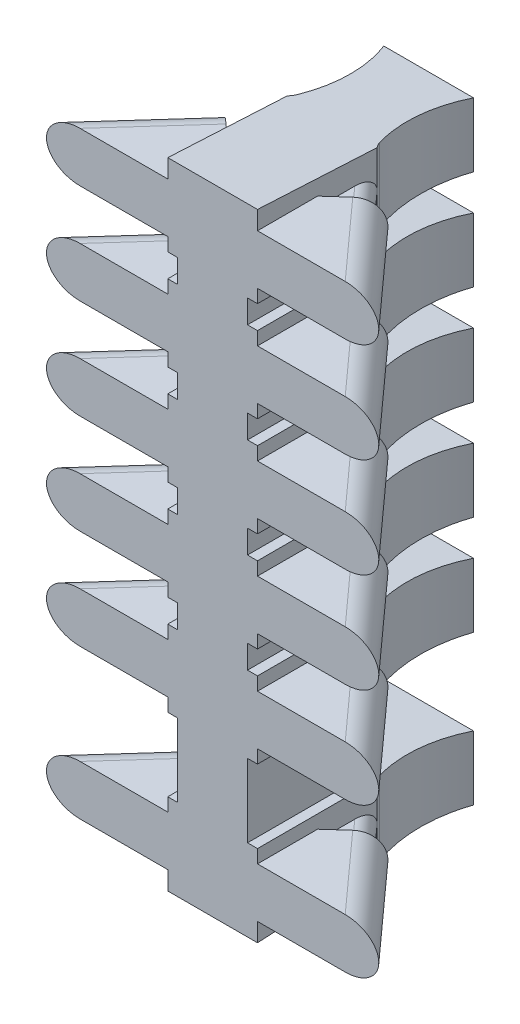
from build123d import *

# Parameters (mm, degrees)
SKETCH1_W           = 15
SKETCH1_H           = 30
BOSS_EXTRUDE1_DEPTH = 7
CUT_EXTRUDE1_START  = -0.3
CUT_EXTRUDE1_DEPTH  = 2.1
CUT_EXTRUDE4_DEPTH  = 2.7
BOSS_EXTRUDE2_DEPTH = 24.556743
CUT_EXTRUDE2_DEPTH  = 27.627139608
CUT_EXTRUDE3_DEPTH  = 27.401285317
SKETCH13_W          = 10
SKETCH13_H          = 20
BOSS_EXTRUDE3_DEPTH = 7


with BuildPart() as part:
    # Sketch1 → Boss-Extrude1 (new body)
    with BuildSketch(Plane.XY):
        Rectangle(SKETCH1_W, SKETCH1_H)
    extrude(amount=-BOSS_EXTRUDE1_DEPTH)

    # Sketch8 → Cut-Extrude1 (cut)
    with BuildSketch(Plane(origin=(1.35, 0, 0), x_dir=(0, 0, -1), z_dir=(1, 0, 0)).offset(CUT_EXTRUDE1_START)):
        Polygon((6.5, -4.716092451), (6.5, -2.783907549), (3, -2.600480321), (3, -1.899519679), (6.5, -1.716092451), (6.5, 0.216092451), (3, 0.399519679), (3, 1.100480321), (6.5, 1.283907549), (6.5, 3.216092451), (3, 3.399519679), (3, 4.100480321), (6.5, 4.283907549), (6.5, 6.216092451), (3, 6.399519679), (3, 7.100480321), (6.5, 7.283907549), (6.5, 9.216092451), (0, 9.556743017), (0, -9.556743017), (6.5, -9.216092451), (6.5, -7.283907549), (3, -7.100480321), (3, -4.899519679), align=None)
    extrude(amount=-CUT_EXTRUDE1_DEPTH, mode=Mode.SUBTRACT)

    # Sketch7 → Cut-Extrude4 (cut)
    with BuildSketch(Plane(origin=(1.35, 0, 0), x_dir=(0, 0, -1), z_dir=(1, 0, 0))):
        Polygon((3, 4.100480321), (0, 4.100480321), (0, 6.399519679), (3, 6.399519679), (6.5, 6.216092451), (6.5, 4.283907549), align=None)
        Polygon((3, 1.100480321), (0, 1.100480321), (0, 3.399519679), (3, 3.399519679), (6.5, 3.216092451), (6.5, 1.283907549), align=None)
        Polygon((3, -1.899519679), (0, -1.899519679), (0, 0.399519679), (3, 0.399519679), (6.5, 0.216092451), (6.5, -1.716092451), align=None)
        Polygon((3, -4.899519679), (0, -4.899519679), (0, -2.600480321), (3, -2.600480321), (6.5, -2.783907549), (6.5, -4.716092451), align=None)
        Polygon((3, -7.100480321), (0, -7.100480321), (0, -9.556743017), (6.5, -9.216092451), (6.5, -7.283907549), align=None)
        Polygon((3, 7.100480321), (0, 7.100480321), (0, 9.556743017), (6.5, 9.216092451), (6.5, 7.283907549), align=None)
    extrude(amount=-CUT_EXTRUDE4_DEPTH, mode=Mode.SUBTRACT)

    # Sketch10 → Boss-Extrude2 (add)
    with BuildSketch(Plane(origin=(0, -9.556743017, 0), x_dir=(1, 0, 0), z_dir=(0, 1, 0))):
        with BuildLine():
            Line((1.35, 3.599507213), (1.35, 6.5))
            ThreePointArc((1.35, 6.5), (1.052815056, 5.148153684), (1.246508191, 3.777646361))
            ThreePointArc((1.246508191, 3.777646361), (1.288979573, 3.683188656), (1.35, 3.599507213))
        make_face()
        with BuildLine():
            Line((-1.35, 3.599507213), (-1.35, 6.5))
            ThreePointArc((-1.35, 6.5), (-1.052815056, 5.148153684), (-1.246508191, 3.777646361))
            ThreePointArc((-1.246508191, 3.777646361), (-1.288979573, 3.683188656), (-1.35, 3.599507213))
        make_face()
    extrude(amount=BOSS_EXTRUDE2_DEPTH)

    # Sketch12 → Cut-Extrude2 (cut, through all)
    with BuildSketch(Plane(origin=(3.10411931, 9.156194078, -3.38952842), x_dir=(0, -1, 0), z_dir=(0.669702306213578, 0, 0.7426296661541438))):
        with BuildLine():
            Line((0.156194078, -1.612037756), (0.156194078, -5.06124645))
            Line((0.156194078, -5.06124645), (1.656194078, -5.06124645))
            Line((1.656194078, -5.06124645), (1.656194078, -1.612037756))
            ThreePointArc((1.656194078, -1.612037756), (0.906194078, -0.862037756), (0.156194078, -1.612037756))
        make_face()
        with BuildLine():
            Line((3.156194078, -1.612037756), (3.156194078, -5.06124645))
            Line((3.156194078, -5.06124645), (4.656194078, -5.06124645))
            Line((4.656194078, -5.06124645), (4.656194078, -1.612037756))
            ThreePointArc((4.656194078, -1.612037756), (3.906194078, -0.862037756), (3.156194078, -1.612037756))
        make_face()
        with BuildLine():
            Line((6.156194078, -1.612037756), (6.156194078, -5.06124645))
            Line((6.156194078, -5.06124645), (7.656194078, -5.06124645))
            Line((7.656194078, -5.06124645), (7.656194078, -1.612037756))
            ThreePointArc((7.656194078, -1.612037756), (6.906194078, -0.862037756), (6.156194078, -1.612037756))
        make_face()
        with BuildLine():
            Line((9.156194078, -1.612037756), (9.156194078, -5.06124645))
            Line((9.156194078, -5.06124645), (10.656194078, -5.06124645))
            Line((10.656194078, -5.06124645), (10.656194078, -1.612037756))
            ThreePointArc((10.656194078, -1.612037756), (9.906194078, -0.862037756), (9.156194078, -1.612037756))
        make_face()
        with BuildLine():
            Line((12.156194078, -1.612037756), (12.156194078, -5.06124645))
            Line((12.156194078, -5.06124645), (13.656194078, -5.06124645))
            Line((13.656194078, -5.06124645), (13.656194078, -1.612037756))
            ThreePointArc((13.656194078, -1.612037756), (12.906194078, -0.862037756), (12.156194078, -1.612037756))
        make_face()
        with BuildLine():
            Line((16.656194078, -1.612037756), (16.656194078, -5.06124645))
            Line((16.656194078, -5.06124645), (18.156194078, -5.06124645))
            Line((18.156194078, -5.06124645), (18.156194078, -1.612037756))
            ThreePointArc((18.156194078, -1.612037756), (17.406194078, -0.862037756), (16.656194078, -1.612037756))
        make_face()
    cut_extrude2 = extrude(amount=CUT_EXTRUDE2_DEPTH, mode=Mode.SUBTRACT)

    # Sketch11 → Cut-Extrude3 (cut, through all)
    with BuildSketch(Plane(origin=(2.212963711, 9.156194078, -4.377726578), x_dir=(0, -1, 0), z_dir=(0.6697023062135781, 0, 0.7426296661541438))):
        with BuildLine():
            Line((0.456194078, -2.362037756), (0.456194078, -1.612037756))
            ThreePointArc((0.456194078, -1.612037756), (0.906194078, -1.162037756), (1.356194078, -1.612037756))
            Line((1.356194078, -1.612037756), (1.356194078, -2.362037756))
            Line((1.356194078, -2.362037756), (0.456194078, -2.362037756))
        make_face()
        with BuildLine():
            Line((3.456194078, -1.612037756), (3.456194078, -2.362037756))
            Line((3.456194078, -2.362037756), (4.356194078, -2.362037756))
            Line((4.356194078, -2.362037756), (4.356194078, -1.612037756))
            ThreePointArc((4.356194078, -1.612037756), (3.906194078, -1.162037756), (3.456194078, -1.612037756))
        make_face()
        with BuildLine():
            Line((7.356194078, -1.612037756), (7.356194078, -2.362037756))
            Line((7.356194078, -2.362037756), (6.456194078, -2.362037756))
            Line((6.456194078, -2.362037756), (6.456194078, -1.612037756))
            ThreePointArc((6.456194078, -1.612037756), (6.906194078, -1.162037756), (7.356194078, -1.612037756))
        make_face()
        with BuildLine():
            Line((9.456194078, -1.612037756), (9.456194078, -2.362037756))
            Line((9.456194078, -2.362037756), (10.356194078, -2.362037756))
            Line((10.356194078, -2.362037756), (10.356194078, -1.612037756))
            ThreePointArc((10.356194078, -1.612037756), (9.906194078, -1.162037756), (9.456194078, -1.612037756))
        make_face()
        with BuildLine():
            Line((13.356194078, -1.612037756), (13.356194078, -2.362037756))
            Line((13.356194078, -2.362037756), (12.456194078, -2.362037756))
            Line((12.456194078, -2.362037756), (12.456194078, -1.612037756))
            ThreePointArc((12.456194078, -1.612037756), (12.906194078, -1.162037756), (13.356194078, -1.612037756))
        make_face()
        with BuildLine():
            Line((16.956194078, -1.612037756), (16.956194078, -2.362037756))
            Line((16.956194078, -2.362037756), (17.856194078, -2.362037756))
            Line((17.856194078, -2.362037756), (17.856194078, -1.612037756))
            ThreePointArc((17.856194078, -1.612037756), (17.406194078, -1.162037756), (16.956194078, -1.612037756))
        make_face()
    cut_extrude3 = extrude(amount=CUT_EXTRUDE3_DEPTH, mode=Mode.SUBTRACT)

    # Mirror1: Cut-Extrude2, Cut-Extrude3 across plane
    add(cut_extrude2.mirror(Plane(origin=(0, 0, 0), x_dir=(0, 0, 1), z_dir=(1, 0, 0))), mode=Mode.SUBTRACT)
    add(cut_extrude3.mirror(Plane(origin=(0, 0, 0), x_dir=(0, 0, 1), z_dir=(1, 0, 0))), mode=Mode.SUBTRACT)


with BuildPart() as body_2:
    # Sketch13 → Boss-Extrude3 (new body)
    with BuildSketch(Plane.XY):
        Rectangle(SKETCH13_W, SKETCH13_H)
    extrude(amount=-BOSS_EXTRUDE3_DEPTH)

    # Combine1: cut part
    add(part.part, mode=Mode.SUBTRACT)


solid = body_2.part
